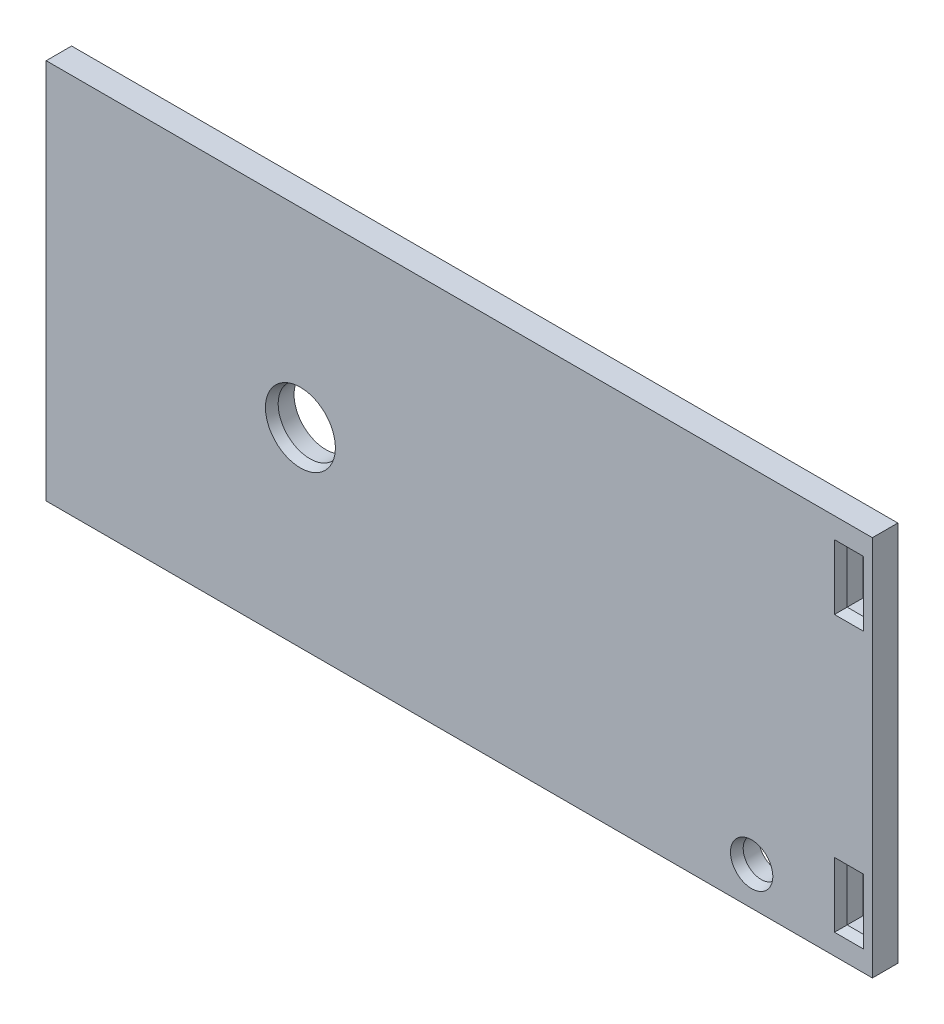
from build123d import *

# Parameters (mm, degrees)
SKETCH1_W           = 130
SKETCH1_H           = 60
SKETCH1_R           = 5
SKETCH1_R_2         = 2.83
SKETCH1_W_2         = 3.53
SKETCH1_H_2         = 9.2
BOSS_EXTRUDE1_DEPTH = 2
CHAMFER1_SIZE       = 0.5
CHAMFER1_SIZE2      = 1.5


with BuildPart() as part:
    # Sketch1 → Boss-Extrude1 (new, symmetric)
    with BuildSketch(Plane.XY):
        Rectangle(SKETCH1_W, SKETCH1_H)
        with Locations((-25, 0)):
            Circle(SKETCH1_R, mode=Mode.SUBTRACT)
        with Locations((46, -24)):
            Circle(SKETCH1_R_2, mode=Mode.SUBTRACT)
        with Locations((61.3, 21.65)):
            Rectangle(SKETCH1_W_2, SKETCH1_H_2, mode=Mode.SUBTRACT)
        with Locations((61.3, -21.65)):
            Rectangle(SKETCH1_W_2, SKETCH1_H_2, mode=Mode.SUBTRACT)
    extrude(amount=BOSS_EXTRUDE1_DEPTH, both=True)

    # Chamfer1
    chamfer1_edges = [part.edges().sort_by_distance(p)[0] for p in [
        (59.535, -21.65, 2),
        (61.3, -26.25, 2),
        (63.065, -21.65, 2),
        (61.3, -17.05, 2),
        (43.17, -24, 2),
        (-30, 0, 2),
        (59.535, 21.65, 2),
        (61.3, 17.05, 2),
        (63.065, 21.65, 2),
        (61.3, 26.25, 2),
    ]]
    chamfer1_side = [part.faces().sort_by_distance(p)[0] for p in [
        (-0.416106653, 0.079128468, 2),
    ]]
    chamfer(chamfer1_edges, length=CHAMFER1_SIZE, length2=CHAMFER1_SIZE2, reference=chamfer1_side[0])


solid = part.part
